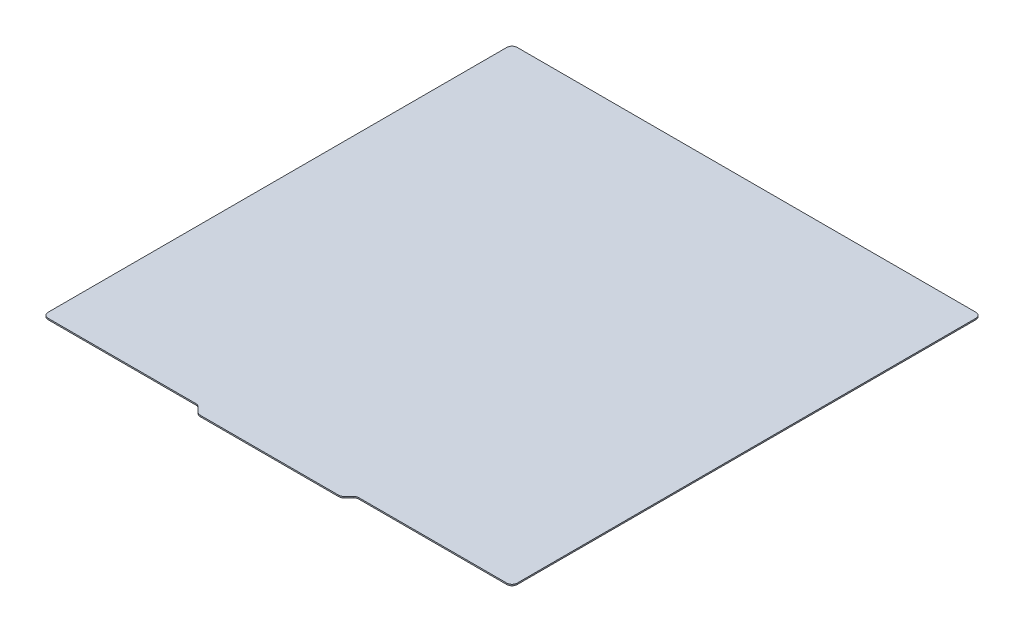
from build123d import *

# Parameters (mm, degrees)
BOSS_EXTRUDE1_DEPTH = 1
FILLET1_R           = 4


with BuildPart() as part:
    # Sketch1 → Boss-Extrude1 (new body)
    with BuildSketch(Plane(origin=(0, 0, 0), x_dir=(1, 0, 0), z_dir=(0, 1, 0))):
        Polygon((-60, -177.5), (-54, -183.5), (54, -183.5), (60, -177.5), (177.5, -177.5), (177.5, 177.5), (-177.5, 177.5), (-177.5, -177.5), align=None)
    extrude(amount=BOSS_EXTRUDE1_DEPTH)

    # Fillet1
    fillet1_edges = [part.edges().sort_by_distance(p)[0] for p in [
        (60, 0.5, 177.5),
        (54, 0.5, 183.5),
        (-54, 0.5, 183.5),
        (-60, 0.5, 177.5),
        (-177.5, 0.5, 177.5),
        (-177.5, 0.5, -177.5),
        (177.5, 0.5, -177.5),
        (177.5, 0.5, 177.5),
    ]]
    fillet(fillet1_edges, radius=FILLET1_R)


solid = part.part
